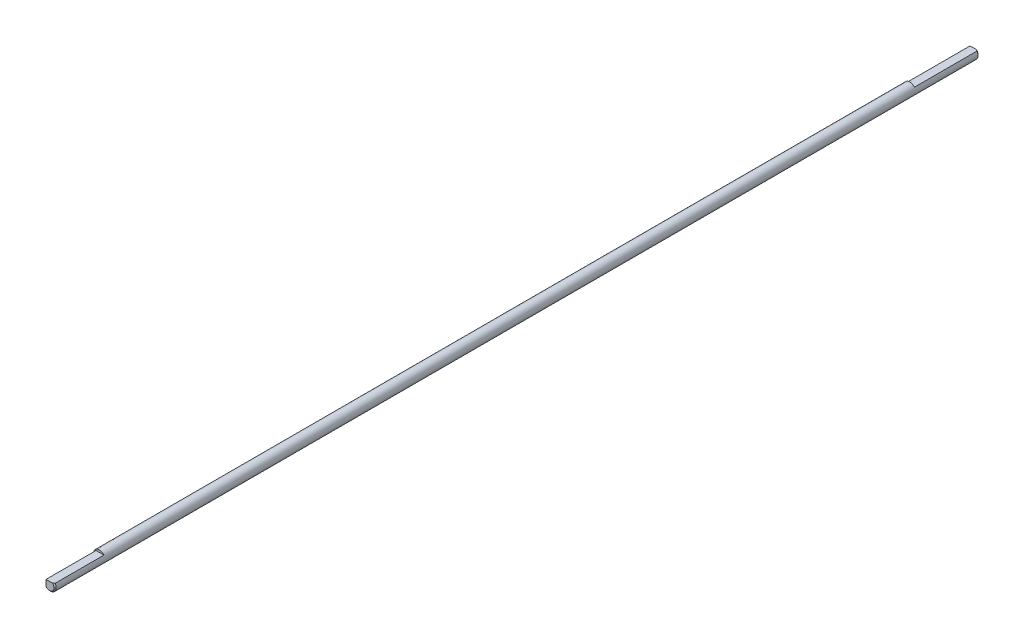
from build123d import *

# Parameters (mm, degrees)
SKETCH_1_R        = 2.5
BODY_DEPTH        = 406.5
CHAMFEREDGES_SIZE = 0.5
SKETCH2_W         = 28.630475487
SKETCH2_H         = 2.50986962
SKETCH2_W_2       = 28
SKETCH2_H_2       = 1.942146438
FIRSTSLOTS_DEPTH  = 407.515374863
CIRPATTERN1_COUNT = 2
CIRPATTERN1_ANGLE = 90


with BuildPart() as part:
    # Эскиз1 → Body (new body)
    with BuildSketch(Plane.XY):
        with Locations(Location((0, 0, 0), (0, 0, 180))):
            Circle(SKETCH_1_R)
    extrude(amount=BODY_DEPTH)

    # ChamferEdges
    chamferedges_edges = [part.edges().sort_by_distance(p)[0] for p in [
        (2.5, 0, 0),
        (2.5, 0, 406.5),
    ]]
    chamfer(chamferedges_edges, length=CHAMFEREDGES_SIZE)

    # Sketch2 → FirstSlots (cut, symmetric)
    with BuildSketch(Plane(origin=(0, 0, 0), x_dir=(0, 0, -1), z_dir=(1, 0, 0))):
        with Locations((-13.684762257, 2.75493481)):
            Rectangle(SKETCH2_W, SKETCH2_H)
        with Locations((-398.5, 2.471073219)):
            Rectangle(SKETCH2_W_2, SKETCH2_H_2)
    firstslots = extrude(amount=FIRSTSLOTS_DEPTH, both=True, mode=Mode.SUBTRACT)

    # CirPattern1: FirstSlots ×2 about axis
    cirpattern1_axis = Axis((0, 0, 406.5), (0, 0, 1))
    for i in range(1, CIRPATTERN1_COUNT):
        add(firstslots.rotate(cirpattern1_axis, i * CIRPATTERN1_ANGLE / (CIRPATTERN1_COUNT - 1)), mode=Mode.SUBTRACT)


solid = part.part
